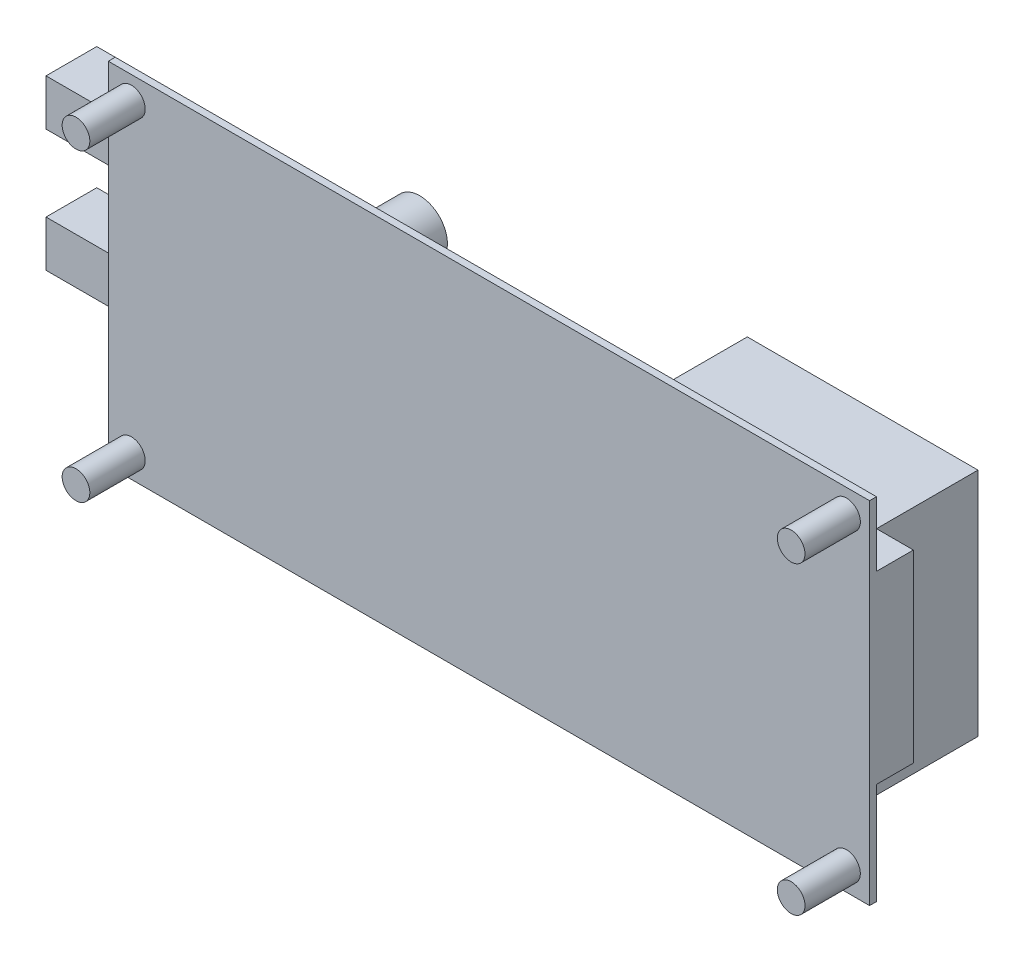
from build123d import *

# Parameters (mm, degrees)
SKETCH1_W           = 165
SKETCH1_H           = 76
BOSS_EXTRUDE1_DEPTH = 1.5
CUT_EXTRUDE1_REACH  = 140.731
SKETCH2_R           = 1.5
SKETCH3_W           = 12
SKETCH3_H           = 40
BOSS_EXTRUDE2_DEPTH = 8
SKETCH4_W           = 50
SKETCH4_H           = 50
BOSS_EXTRUDE3_DEPTH = 32
SKETCH5_W           = 30
SKETCH5_H           = 10
BOSS_EXTRUDE4_DEPTH = 11
SKETCH6_R           = 6
BOSS_EXTRUDE5_DEPTH = 25
SKETCH7_R           = 3
BOSS_EXTRUDE6_DEPTH = 12


with BuildPart() as part:
    # Sketch1 → Boss-Extrude1 (new body)
    with BuildSketch(Plane.XY):
        with Locations((47.261306533, -11.052763819)):
            Rectangle(SKETCH1_W, SKETCH1_H)
    extrude(amount=BOSS_EXTRUDE1_DEPTH)

    # Sketch2 → Cut-Extrude1 (cut, up to next)
    with BuildSketch(Plane.XY.offset(1.5), mode=Mode.PRIVATE) as cut_extrude1_sk1:
        with Locations((124.761306533, 21.947236181)):
            Circle(SKETCH2_R)
    cut_extrude1_tool1 = extrude(cut_extrude1_sk1.sketch, amount=-CUT_EXTRUDE1_REACH, mode=Mode.PRIVATE) & part.part
    # Sketch2 → Cut-Extrude1 (cut, up to next)
    with BuildSketch(Plane.XY.offset(1.5), mode=Mode.PRIVATE) as cut_extrude1_sk2:
        with Locations((124.761306533, -44.052763819)):
            Circle(SKETCH2_R)
    cut_extrude1_tool2 = extrude(cut_extrude1_sk2.sketch, amount=-CUT_EXTRUDE1_REACH, mode=Mode.PRIVATE) & part.part
    # Sketch2 → Cut-Extrude1 (cut, up to next)
    with BuildSketch(Plane.XY.offset(1.5), mode=Mode.PRIVATE) as cut_extrude1_sk3:
        with Locations((-30.238693467, -44.052763819)):
            Circle(SKETCH2_R)
    cut_extrude1_tool3 = extrude(cut_extrude1_sk3.sketch, amount=-CUT_EXTRUDE1_REACH, mode=Mode.PRIVATE) & part.part
    # Sketch2 → Cut-Extrude1 (cut, up to next)
    with BuildSketch(Plane.XY.offset(1.5), mode=Mode.PRIVATE) as cut_extrude1_sk4:
        with Locations((-30.238693467, 21.947236181)):
            Circle(SKETCH2_R)
    cut_extrude1_tool4 = extrude(cut_extrude1_sk4.sketch, amount=-CUT_EXTRUDE1_REACH, mode=Mode.PRIVATE) & part.part
    add(cut_extrude1_tool1.solids().sort_by_distance((124.761307, 21.947236, 1.5))[0], mode=Mode.SUBTRACT)
    add(cut_extrude1_tool2.solids().sort_by_distance((124.761307, -44.052764, 1.5))[0], mode=Mode.SUBTRACT)
    add(cut_extrude1_tool3.solids().sort_by_distance((-30.238693, -44.052764, 1.5))[0], mode=Mode.SUBTRACT)
    add(cut_extrude1_tool4.solids().sort_by_distance((-30.238693, 21.947236, 1.5))[0], mode=Mode.SUBTRACT)

    # Sketch3 → Boss-Extrude2 (add)
    with BuildSketch(Plane(origin=(0, 0, 0), x_dir=(-1, 0, 0), z_dir=(0, 0, -1))):
        with Locations((-123.761306533, -7.052763819)):
            Rectangle(SKETCH3_W, SKETCH3_H)
    extrude(amount=BOSS_EXTRUDE2_DEPTH)

    # Sketch4 → Boss-Extrude3 (add)
    with BuildSketch(Plane(origin=(0, 0, 0), x_dir=(-1, 0, 0), z_dir=(0, 0, -1))):
        with Locations((-94.761306533, -14.052763819)):
            Rectangle(SKETCH4_W, SKETCH4_H)
    extrude(amount=BOSS_EXTRUDE3_DEPTH)

    # Sketch5 → Boss-Extrude4 (add)
    with BuildSketch(Plane(origin=(0, 0, 0), x_dir=(-1, 0, 0), z_dir=(0, 0, -1))):
        with Locations((35.238693467, 10.947236181)):
            Rectangle(SKETCH5_W, SKETCH5_H)
        with Locations((35.238693467, -15.552763819)):
            Rectangle(SKETCH5_W, SKETCH5_H)
    extrude(amount=BOSS_EXTRUDE4_DEPTH)

    # Sketch6 → Boss-Extrude5 (add)
    with BuildSketch(Plane(origin=(0, 0, 0), x_dir=(-1, 0, 0), z_dir=(0, 0, -1))):
        with Locations(Location((-5.761306533, 2.947236181, 0), (0, 0, 180))):
            Circle(SKETCH6_R)
    extrude(amount=BOSS_EXTRUDE5_DEPTH)

    # Sketch7 → Boss-Extrude6 (add)
    with BuildSketch(Plane.XY.offset(1.5)):
        with Locations((124.761306533, 21.947236181)):
            Circle(SKETCH7_R)
        with Locations(Location((124.761306533, -44.052763819, 0), (0, 0, 180))):
            Circle(SKETCH7_R)
        with Locations(Location((-30.238693467, 21.947236181, 0), (0, 0, 180))):
            Circle(SKETCH7_R)
        with Locations((-30.238693467, -44.052763819)):
            Circle(SKETCH7_R)
    extrude(amount=BOSS_EXTRUDE6_DEPTH)


solid = part.part
